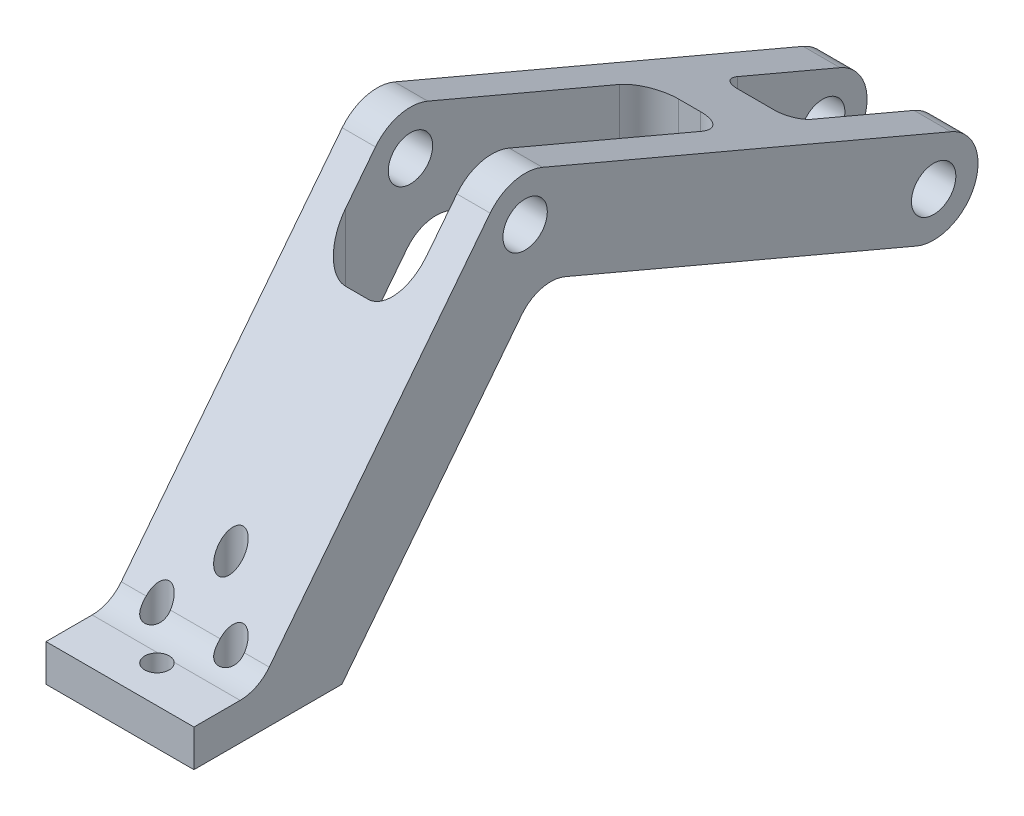
from build123d import *

# Parameters (mm, degrees)
ESBO_O1_R                               = 3
RESSALTO_EXTRUS_O1_DEPTH                = 20
BROCA_DE_ROSQUEAR_PARA_TARRAXA_DE_M42_D = 3.3
CORTE_EXTRUS_O1_DEPTH                   = 50
CORTE_EXTRUS_O2_DEPTH                   = 50


with BuildPart() as part:
    # Esboço1 → Ressalto-extrusão1 (new body)
    with BuildSketch(Plane(origin=(0, 0, 0), x_dir=(0, 0, -1), z_dir=(1, 0, 0))):
        with BuildLine():
            Line((0, 0), (0, 5))
            Line((0, 5), (6.239506285, 5))
            ThreePointArc((6.239506285, 5), (8.431241444, 5.505970962), (10.179394863, 6.921481202))
            Line((10.179394863, 6.921481202), (40.043100593, 45.14105393))
            ThreePointArc((40.043100593, 45.14105393), (43.268998574, 47.25579782), (47.115650024, 46.969734684))
            Line((47.115650024, 46.969734684), (102.344683137, 23.522903311))
            ThreePointArc((102.344683137, 23.522903311), (105.522903311, 15.655316863), (97.655316863, 12.477096689))
            Line((97.655316863, 12.477096689), (50.195717148, 32.625507204))
            ThreePointArc((50.195717148, 32.625507204), (46.990174273, 32.86389315), (44.301925956, 31.101606576))
            Line((44.301925956, 31.101606576), (20, 0))
            Line((20, 0), (0, 0))
        make_face()
        with Locations((44.770966887, 41.446831372)):
            Circle(ESBO_O1_R, mode=Mode.SUBTRACT)
        with Locations((100, 18)):
            Circle(ESBO_O1_R, mode=Mode.SUBTRACT)
    extrude(amount=RESSALTO_EXTRUS_O1_DEPTH)

    # Broca de rosquear para tarraxa de M42 (through all)
    with Locations(Plane(origin=(0, 0, 0), x_dir=(-1, 0, 0), z_dir=(0, -1, 0))):
        with Locations((-10, 15), (-10, 5), (-5, 10), (-15, 10)):
            Hole(BROCA_DE_ROSQUEAR_PARA_TARRAXA_DE_M42_D / 2)

    # Esboço10 → Corte-extrusão1 (cut)
    with BuildSketch(Plane(origin=(0, 0, 0), x_dir=(1, 0, 0), z_dir=(0, 1, 0))):
        with BuildLine():
            Line((4.5, 36), (4.5, 73))
            ThreePointArc((4.5, 73), (5.671572875, 75.828427125), (8.5, 77))
            Line((8.5, 77), (11.5, 77))
            ThreePointArc((11.5, 77), (14.328427125, 75.828427125), (15.5, 73))
            Line((15.5, 73), (15.5, 36))
            ThreePointArc((15.5, 36), (14.328427125, 33.171572875), (11.5, 32))
            Line((11.5, 32), (8.5, 32))
            ThreePointArc((8.5, 32), (5.671572875, 33.171572875), (4.5, 36))
        make_face()
    extrude(amount=CORTE_EXTRUS_O1_DEPTH, mode=Mode.SUBTRACT)

    # Esboço11 → Corte-extrusão2 (cut)
    with BuildSketch(Plane(origin=(0, 0, 0), x_dir=(1, 0, 0), z_dir=(0, 1, 0))):
        with BuildLine():
            Line((5, 106), (5, 88.5))
            ThreePointArc((5, 88.5), (5.732233047, 86.732233047), (7.5, 86))
            Line((7.5, 86), (12.5, 86))
            ThreePointArc((12.5, 86), (14.267766953, 86.732233047), (15, 88.5))
            Line((15, 88.5), (15, 106))
            Line((15, 106), (5, 106))
        make_face()
    extrude(amount=CORTE_EXTRUS_O2_DEPTH, mode=Mode.SUBTRACT)


solid = part.part
